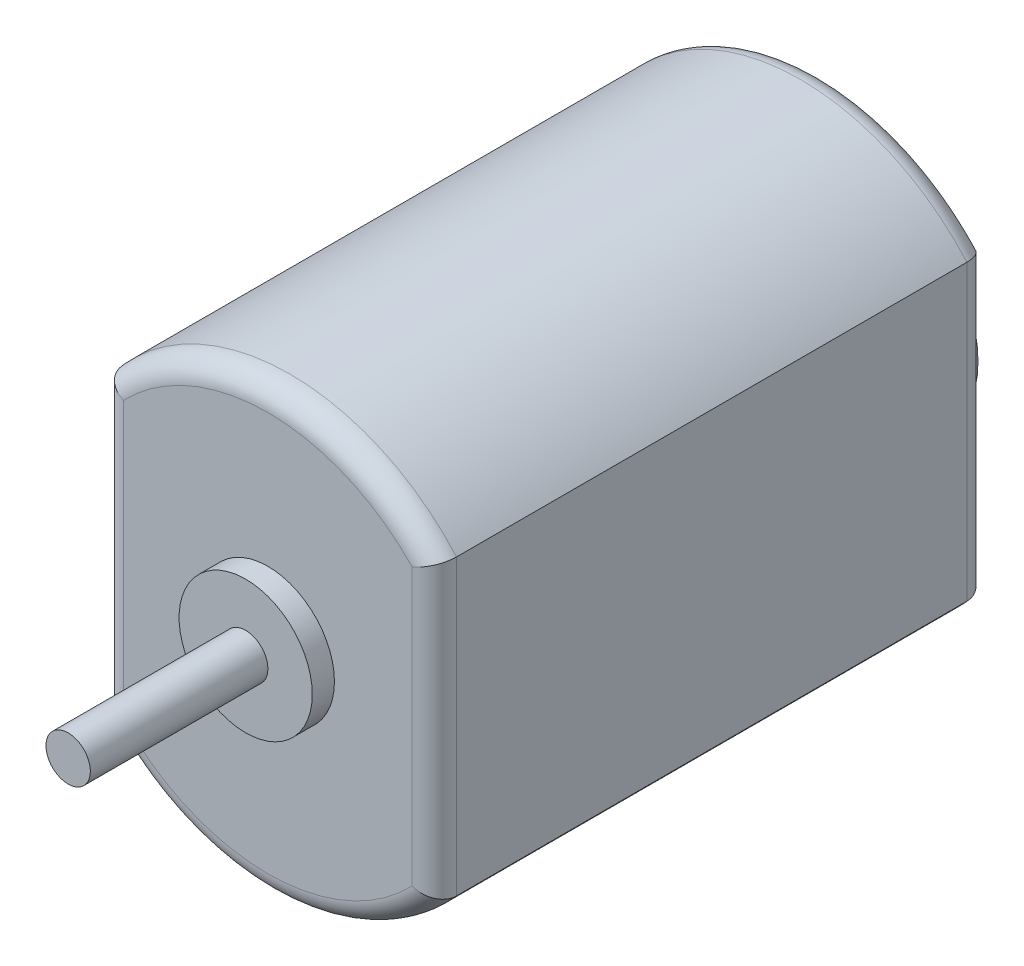
from build123d import *

# Parameters (mm, degrees)
BOSS_EXTRUDE1_DEPTH = 25
SKETCH2_R           = 3
BOSS_EXTRUDE2_DEPTH = 1
SKETCH3_R           = 1
BOSS_EXTRUDE3_DEPTH = 8
BOSS_EXTRUDE4_DEPTH = 2
BOSS_EXTRUDE5_START = 0.5
SKETCH5_R           = 1
BOSS_EXTRUDE5_DEPTH = 0.5
FILLET1_R           = 1
FILLET2_R           = 1


with BuildPart() as part:
    # Sketch1 → Boss-Extrude1 (new body)
    with BuildSketch(Plane.XY):
        with BuildLine():
            Line((-7.5, -6.614378278), (-7.5, 6.614378278))
            ThreePointArc((-7.5, 6.614378278), (0, 10), (7.5, 6.614378278))
            Line((7.5, 6.614378278), (7.5, -6.614378278))
            ThreePointArc((7.5, -6.614378278), (0, -10), (-7.5, -6.614378278))
        make_face()
    extrude(amount=BOSS_EXTRUDE1_DEPTH)

    # Sketch2 → Boss-Extrude2 (add)
    with BuildSketch(Plane.XY.offset(25)):
        Circle(SKETCH2_R)
    extrude(amount=BOSS_EXTRUDE2_DEPTH)

    # Sketch3 → Boss-Extrude3 (add)
    with BuildSketch(Plane.XY.offset(26)):
        Circle(SKETCH3_R)
    extrude(amount=BOSS_EXTRUDE3_DEPTH)

    # Sketch4 → Boss-Extrude4 (add)
    with BuildSketch(Plane(origin=(0, 0, 0), x_dir=(-1, 0, 0), z_dir=(0, 0, -1))):
        with BuildLine():
            Line((4, 3), (4, -3))
            ThreePointArc((4, -3), (-5, 0), (4, 3))
        make_face()
    extrude(amount=BOSS_EXTRUDE4_DEPTH)

    # Sketch5 → Boss-Extrude5 (add)
    with BuildSketch(Plane(origin=(0, 0, -2), x_dir=(-1, 0, 0), z_dir=(0, 0, -1)).offset(BOSS_EXTRUDE5_START)):
        with Locations(Location((0, 0, 0), (0, 0, 180))):
            Circle(SKETCH5_R)
    extrude(amount=-BOSS_EXTRUDE5_DEPTH)

    # Fillet1
    fillet1_edges = [part.edges().sort_by_distance(p)[0] for p in [
        (0, -10, 25),
        (7.5, 0, 25),
        (0, 10, 25),
        (-7.5, 0, 25),
    ]]
    fillet(fillet1_edges, radius=FILLET1_R)

    # Fillet2
    fillet2_edges = [part.edges().sort_by_distance(p)[0] for p in [
        (7.5, 0, 0),
        (0, -10, 0),
        (-7.5, 0, 0),
        (0, 10, 0),
    ]]
    fillet(fillet2_edges, radius=FILLET2_R)


solid = part.part
